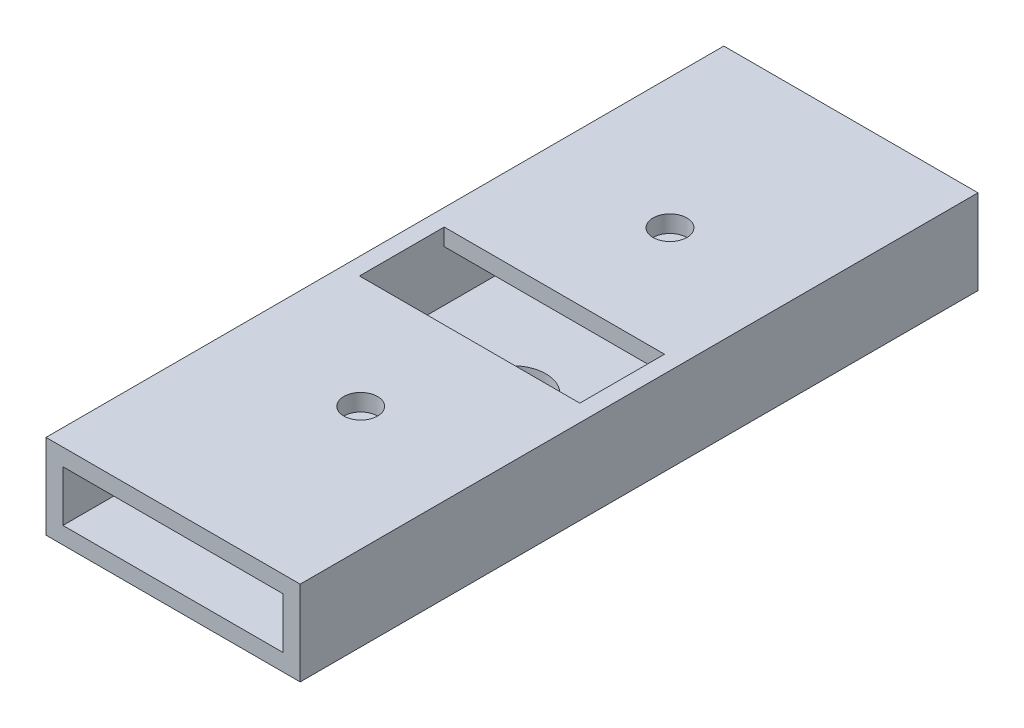
from build123d import *

# Parameters (mm, degrees)
ESBO_O1_W                = 30
ESBO_O1_H                = 10
ESBO_O1_W_2              = 26
ESBO_O1_H_2              = 6
RESSALTO_EXTRUS_O1_DEPTH = 80
ESBO_O2_R                = 4
CORTE_EXTRUS_O1_DEPTH    = 10
ESBO_O3_W                = 26
ESBO_O3_H                = 10
CORTE_EXTRUS_O2_DEPTH    = 2
ESBO_O5_W                = 26
ESBO_O5_H                = 10
CORTE_EXTRUS_O3_DEPTH    = 2
ESBO_O6_R                = 2
CORTE_EXTRUS_O4_DEPTH    = 2
ESBO_O7_R                = 1.25
CORTE_EXTRUS_O5_DEPTH    = 2


with BuildPart() as part:
    # Esboço1 → Ressalto-extrusão1 (new body)
    with BuildSketch(Plane.XY):
        with Locations((15, 5)):
            Rectangle(ESBO_O1_W, ESBO_O1_H)
        with Locations((15, 5)):
            Rectangle(ESBO_O1_W_2, ESBO_O1_H_2, mode=Mode.SUBTRACT)
    extrude(amount=RESSALTO_EXTRUS_O1_DEPTH)

    # Esboço2 → Corte-extrusão1 (cut)
    with BuildSketch(Plane(origin=(0, 10, 0), x_dir=(1, 0, 0), z_dir=(0, 1, 0))):
        with Locations(Location((15, -40, 0), (0, 0, 270))):
            Circle(ESBO_O2_R)
    extrude(amount=-CORTE_EXTRUS_O1_DEPTH, mode=Mode.SUBTRACT)

    # Esboço3 → Corte-extrusão2 (cut)
    with BuildSketch(Plane(origin=(0, 10, 0), x_dir=(1, 0, 0), z_dir=(0, 1, 0))):
        with Locations((15, -40)):
            Rectangle(ESBO_O3_W, ESBO_O3_H)
    extrude(amount=-CORTE_EXTRUS_O2_DEPTH, mode=Mode.SUBTRACT)

    # Esboço5 → Corte-extrusão3 (cut)
    with BuildSketch(Plane(origin=(0, 0, 0), x_dir=(-1, 0, 0), z_dir=(0, -1, 0))):
        with Locations((-15, -58.5)):
            Rectangle(ESBO_O5_W, ESBO_O5_H)
    corte_extrus_o3 = extrude(amount=-CORTE_EXTRUS_O3_DEPTH, mode=Mode.SUBTRACT)

    # Esboço6 → Corte-extrusão4 (cut)
    with BuildSketch(Plane(origin=(0, 8, 0), x_dir=(-1, 0, 0), z_dir=(0, -1, 0))):
        with Locations(Location((-15.391952085, -58.25, 0), (0, 0, 90))):
            Circle(ESBO_O6_R)
    corte_extrus_o4 = extrude(amount=-CORTE_EXTRUS_O4_DEPTH, mode=Mode.SUBTRACT)

    # Espelhar6: Corte-extrusão3, Corte-extrusão4 across plane
    add(corte_extrus_o3.mirror(Plane(origin=(0, 0, 40), x_dir=(1, 0, 0), z_dir=(0, 0, -1))), mode=Mode.SUBTRACT)
    add(corte_extrus_o4.mirror(Plane(origin=(0, 0, 40), x_dir=(1, 0, 0), z_dir=(0, 0, -1))), mode=Mode.SUBTRACT)

    # Esboço7 → Corte-extrusão5 (cut)
    with BuildSketch(Plane(origin=(0, 2, 0), x_dir=(1, 0, 0), z_dir=(0, 1, 0))):
        with Locations(Location((24.53, -40, 0), (0, 0, 270))):
            Circle(ESBO_O7_R)
    corte_extrus_o5 = extrude(amount=-CORTE_EXTRUS_O5_DEPTH, mode=Mode.SUBTRACT)

    # Espelhar7: Corte-extrusão5 across plane
    add(corte_extrus_o5.mirror(Plane.ZY.offset(-15)), mode=Mode.SUBTRACT)


solid = part.part
